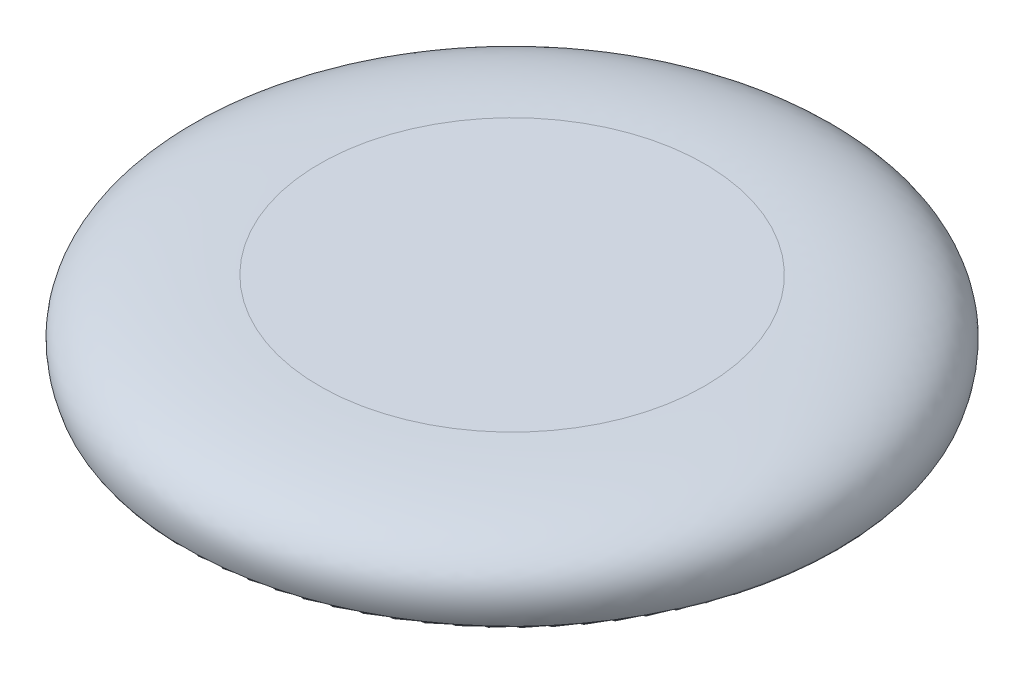
from build123d import *

# Parameters (mm, degrees)
FILLET1_R = 2


with BuildPart() as part:
    # Sketch1 → Revolve1 (revolve)
    with BuildSketch(Plane.XY):
        with BuildLine():
            Line((0, 32), (80, 32))
            add(Edge.make_bspline(
                [(80, 32), (147.5, 32), (135, 0)],
                knots=[0, 0, 0, 1, 1, 1], degree=2, weights=[1, 1, 1]))
            Line((135, 0), (131, 0))
            Line((131, 0), (131.851977883, 16.25670644))
            add(Edge.make_bspline(
                [(80, 29), (80.689072442, 29), (82.076862717, 28.994846466), (84.775164614, 28.96395116), (88.056354116, 28.88678173), (91.829951508, 28.732696964), (96.648299829, 28.445618766), (102.267656424, 27.934437364), (108.361107153, 27.080807389), (113.798438754, 25.992318092), (120.163760179, 24.240442252), (126.444056899, 21.515342649), (129.940253057, 18.671598914), (131.421962962, 16.862146495), (131.729918702, 16.43533592), (131.851977883, 16.25670644)],
                knots=[0, 0, 0, 0, 0.015625, 0.03125, 0.0625, 0.09375, 0.125, 0.1875, 0.25, 0.3125, 0.375, 0.5, 0.625, 0.647010898, 0.662635898, 0.662635898, 0.662635898, 0.662635898], degree=3))
            Line((80, 29), (0, 29))
            Line((0, 29), (0, 32))
        make_face()
    revolve(axis=Axis((0, 0, 0), (0, 1, 0)))

    # Fillet1
    fillet1_edges = [part.edges().sort_by_distance(p)[0] for p in [
        (-131, 0, 0),
        (-135, 0, 0),
    ]]
    fillet(fillet1_edges, radius=FILLET1_R)


solid = part.part
